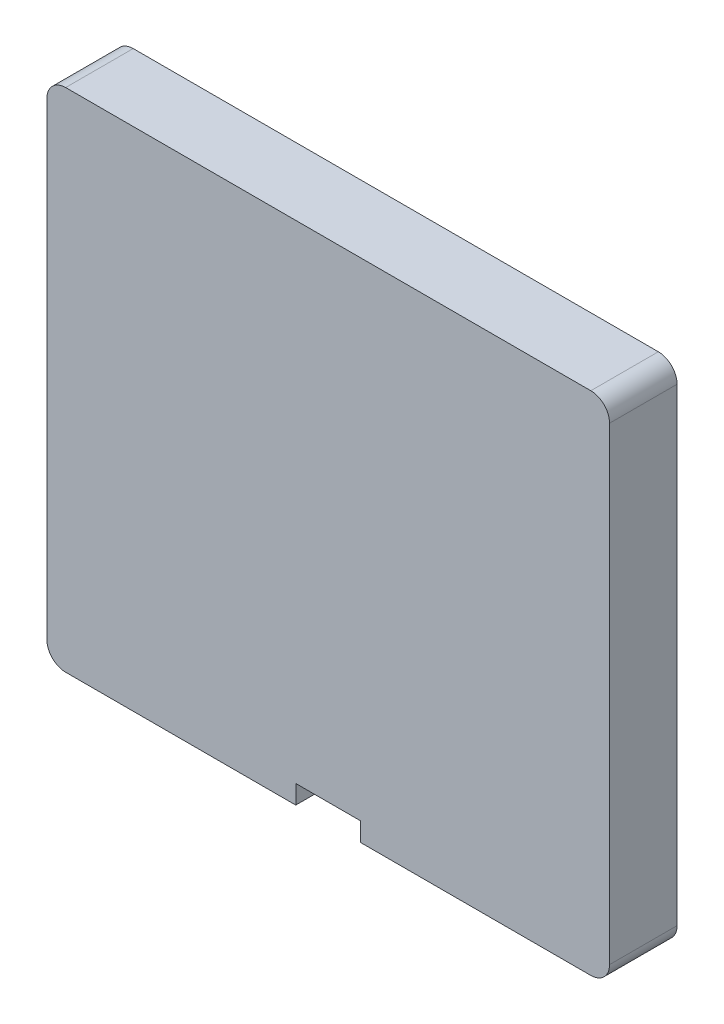
from build123d import *

# Parameters (mm, degrees)
EXTRUDE_1_DEPTH = 18


with BuildPart() as part:
    # 草图1 → 凸台-拉伸1 (new body)
    with BuildSketch(Plane.XY):
        with BuildLine():
            Line((-70, -67.5), (-8.660254038, -67.5))
            Line((-8.660254038, -67.5), (-8.660254038, -62.5))
            Line((-8.660254038, -62.5), (8.660254038, -62.5))
            Line((8.660254038, -62.5), (8.660254038, -67.5))
            Line((8.660254038, -67.5), (70, -67.5))
            ThreePointArc((70, -67.5), (73.535533906, -66.035533906), (75, -62.5))
            Line((75, -62.5), (75, 62.5))
            ThreePointArc((75, 62.5), (73.535533906, 66.035533906), (70, 67.5))
            Line((70, 67.5), (-70, 67.5))
            ThreePointArc((-70, 67.5), (-73.535533906, 66.035533906), (-75, 62.5))
            Line((-75, 62.5), (-75, -62.5))
            ThreePointArc((-75, -62.5), (-73.535533906, -66.035533906), (-70, -67.5))
        make_face()
    extrude(amount=EXTRUDE_1_DEPTH)


solid = part.part
